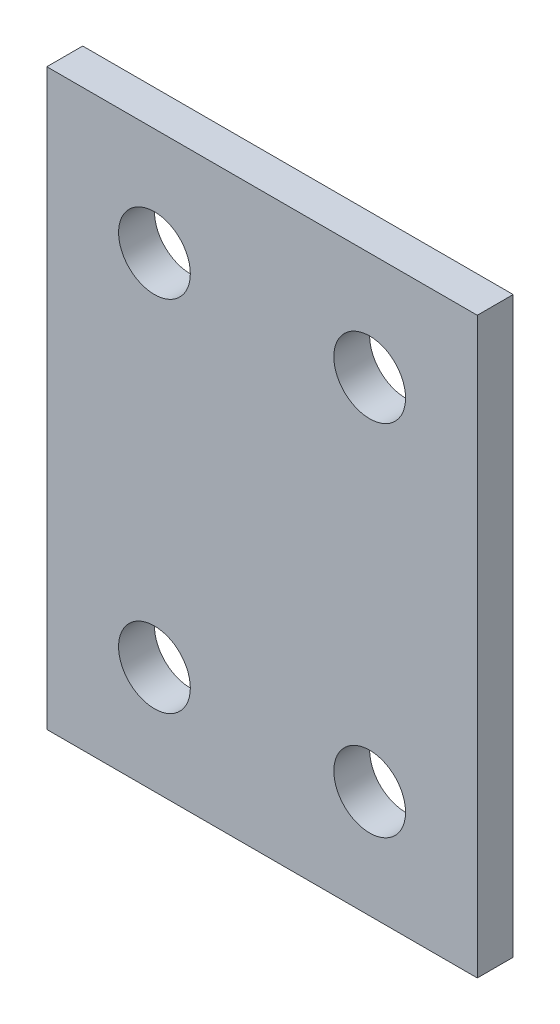
from build123d import *

# Parameters (mm, degrees)
SKETCH1_W      = 60
SKETCH1_H      = 80
SKETCH1_R      = 5
EXTRUDE1_DEPTH = 5


with BuildPart() as part:
    # Sketch1 → Extrude1 (new body)
    with BuildSketch(Plane.XY):
        with Locations((30, 40)):
            Rectangle(SKETCH1_W, SKETCH1_H)
        with Locations((15, 15)):
            Circle(SKETCH1_R, mode=Mode.SUBTRACT)
        with Locations((45, 15)):
            Circle(SKETCH1_R, mode=Mode.SUBTRACT)
        with Locations((15, 65)):
            Circle(SKETCH1_R, mode=Mode.SUBTRACT)
        with Locations((45, 65)):
            Circle(SKETCH1_R, mode=Mode.SUBTRACT)
    extrude(amount=-EXTRUDE1_DEPTH)


solid = part.part
